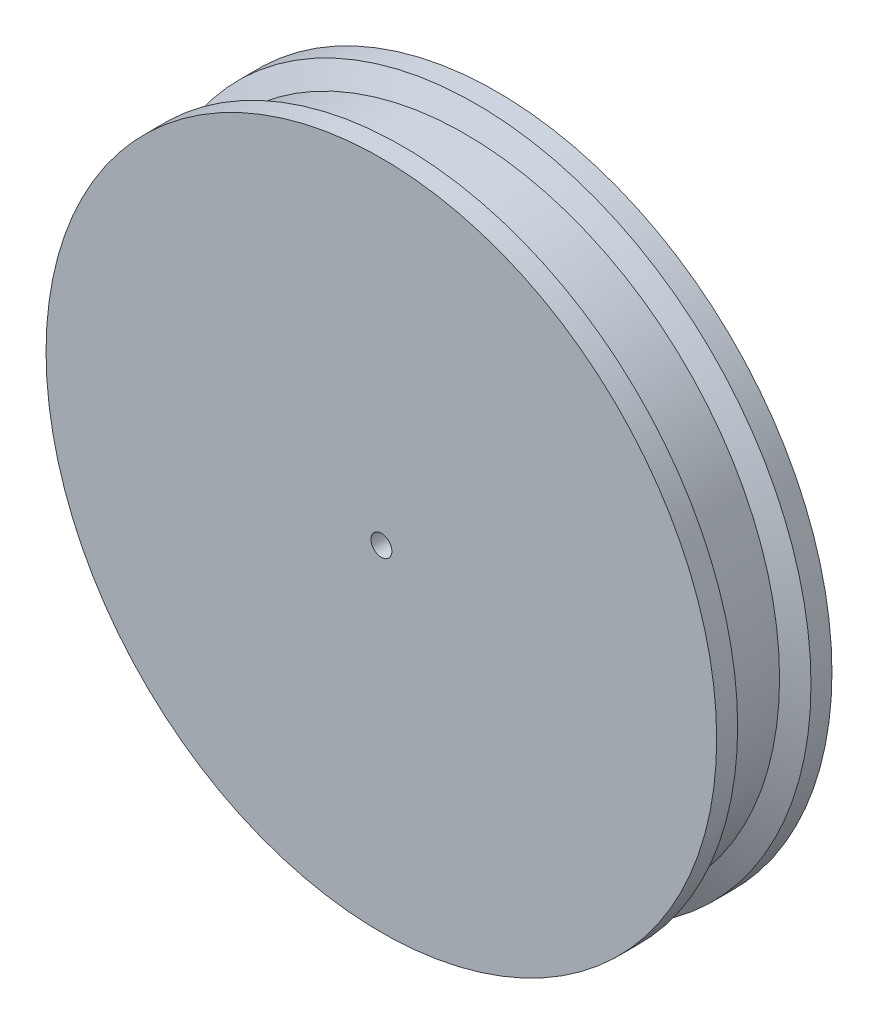
from build123d import *

# Parameters (mm, degrees)
SKETCH1_R           = 32
SKETCH1_R_2         = 1
BOSS_EXTRUDE1_DEPTH = 11


with BuildPart() as part:
    # Sketch1 → Boss-Extrude1 (new body)
    with BuildSketch(Plane.XY):
        Circle(SKETCH1_R)
        Circle(SKETCH1_R_2, mode=Mode.SUBTRACT)
    extrude(amount=BOSS_EXTRUDE1_DEPTH)

    # Sketch4 → Cut-Revolve1 (revolve, cut)
    with BuildSketch(Plane(origin=(0, 0, 0), x_dir=(0, 0, -1), z_dir=(1, 0, 0)), mode=Mode.PRIVATE) as cut_revolve1_sk:
        Polygon((-2, 32), (-3, 30), (-8, 30), (-9, 32), align=None)
    revolve(cut_revolve1_sk.sketch.rotate(Axis((0, 0, 1000), (0, 0, -1)), 90), axis=Axis((0, 0, 1000), (0, 0, -1)), mode=Mode.SUBTRACT)


solid = part.part
